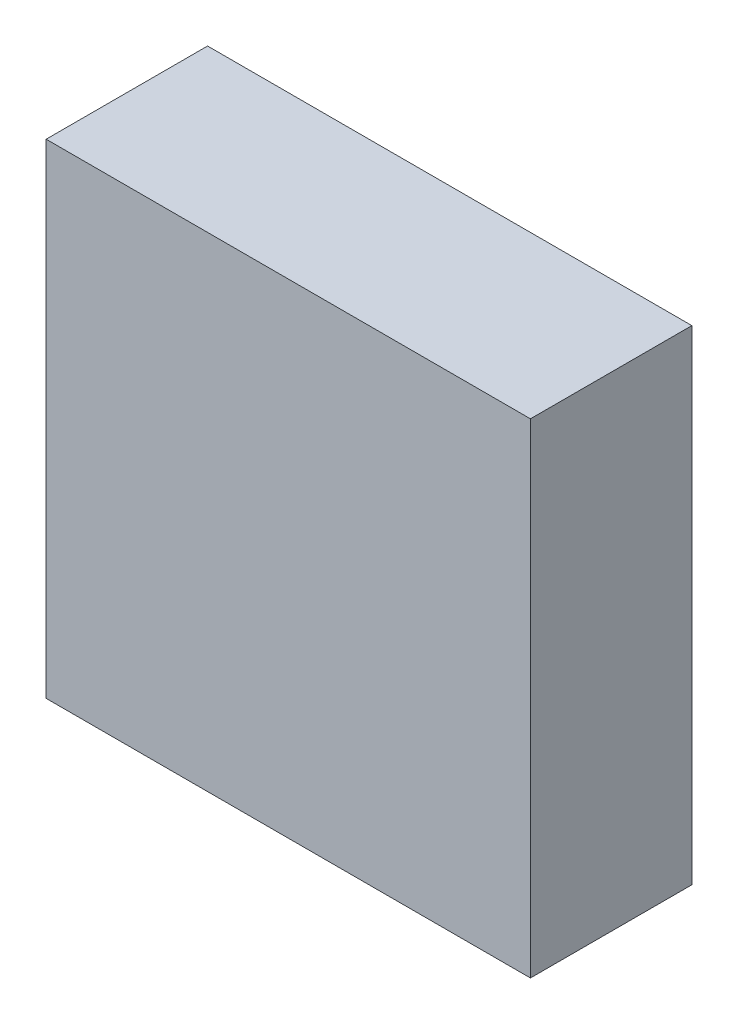
from build123d import *

# Parameters (mm, degrees)
SKETCH1_W           = 9.525
SKETCH1_H           = 9.525
BOSS_EXTRUDE1_DEPTH = 1.5875


with BuildPart() as part:
    # Sketch1 → Boss-Extrude1 (new, symmetric)
    with BuildSketch(Plane.XY):
        Rectangle(SKETCH1_W, SKETCH1_H)
    extrude(amount=BOSS_EXTRUDE1_DEPTH, both=True)


solid = part.part
